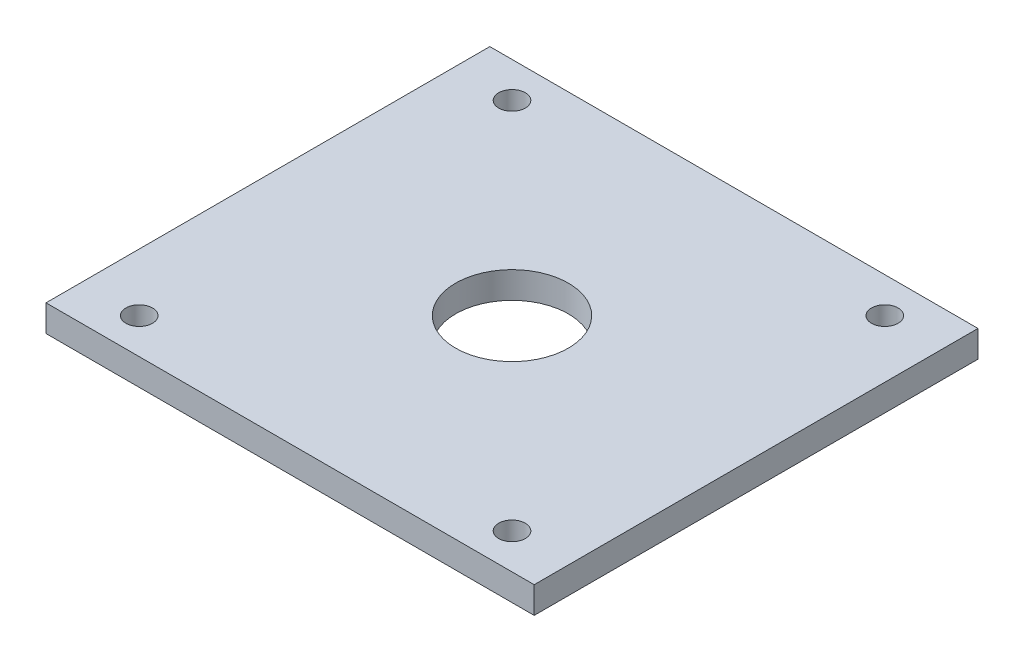
from build123d import *

# Parameters (mm, degrees)
SKETCH1_W           = 55
SKETCH1_H           = 50
BOSS_EXTRUDE1_DEPTH = 3
SKETCH2_R           = 6.35
CUT_EXTRUDE1_DEPTH  = 38.286056375
SKETCH3_R           = 1.5
CUT_EXTRUDE2_DEPTH  = 38.286056375
CIRPATTERN1_COUNT   = 4


with BuildPart() as part:
    # Sketch1 → Boss-Extrude1 (new body)
    with BuildSketch(Plane(origin=(0, 0, 0), x_dir=(1, 0, 0), z_dir=(0, 1, 0))):
        Rectangle(SKETCH1_W, SKETCH1_H)
    extrude(amount=BOSS_EXTRUDE1_DEPTH)

    # Sketch2 → Cut-Extrude1 (cut, through all)
    with BuildSketch(Plane(origin=(0, 3, 0), x_dir=(1, 0, 0), z_dir=(0, 1, 0))):
        with Locations(Location((0, 0, 0), (0, 0, 270))):
            Circle(SKETCH2_R)
    extrude(amount=-CUT_EXTRUDE1_DEPTH, mode=Mode.SUBTRACT)

    # Sketch3 → Cut-Extrude2 (cut, through all)
    with BuildSketch(Plane(origin=(0, 3, 0), x_dir=(1, 0, 0), z_dir=(0, 1, 0))):
        with Locations(Location((-21, 21, 0), (0, 0, 270))):
            Circle(SKETCH3_R)
    cut_extrude2 = extrude(amount=-CUT_EXTRUDE2_DEPTH, mode=Mode.SUBTRACT)

    # CirPattern1: Cut-Extrude2 ×4 about axis
    cirpattern1_axis = Axis((0, 0, 0), (0, 1, 0))
    for i in range(1, CIRPATTERN1_COUNT):
        add(cut_extrude2.rotate(cirpattern1_axis, i * 360 / CIRPATTERN1_COUNT), mode=Mode.SUBTRACT)


solid = part.part
